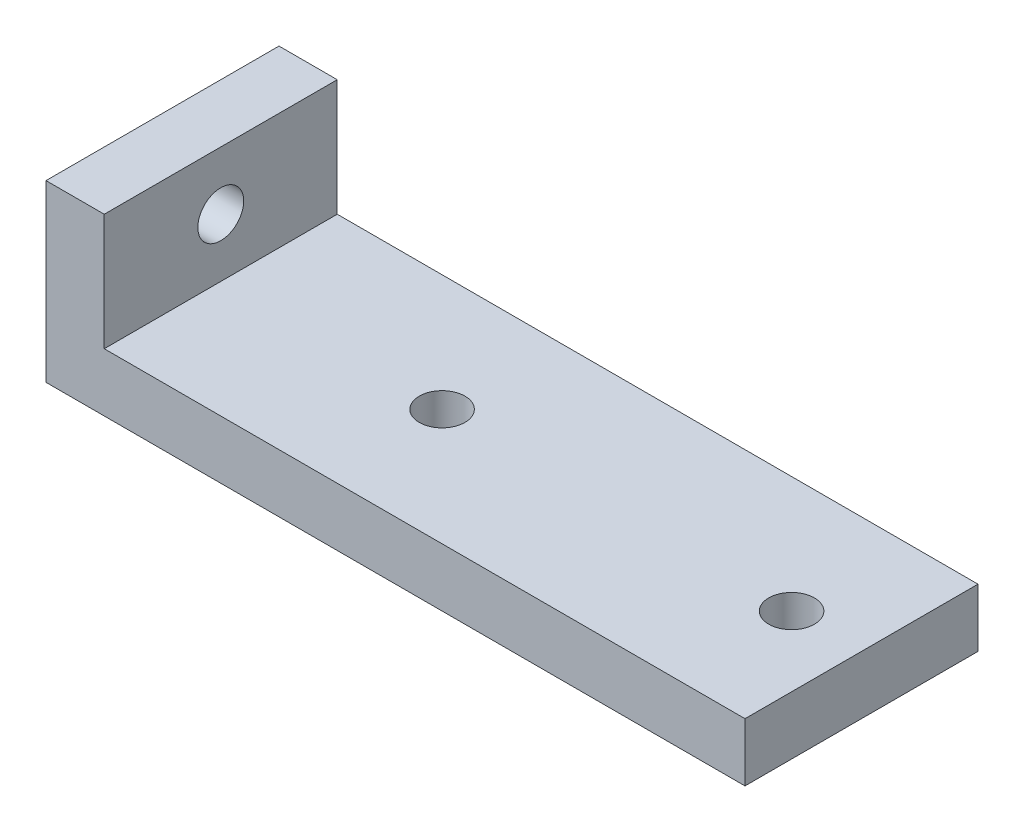
from build123d import *

# Parameters (mm, degrees)
SKETCH1_W                  = 76.2
SKETCH1_H                  = 25.4
BOSS_EXTRUDE1_DEPTH        = 19.05
SKETCH2_W                  = 69.85
SKETCH2_H                  = 12.7
CUT_EXTRUDE1_DEPTH         = 83.55
M6X1_0_TAPPED_HOLE1_D      = 5
F_9_0_196_DIAMETER_HOLE1_D = 4.9784


with BuildPart() as part:
    # Sketch1 → Boss-Extrude1 (new body)
    with BuildSketch(Plane(origin=(0, 0, 0), x_dir=(1, 0, 0), z_dir=(0, 1, 0))):
        with Locations((-38.1, 12.7)):
            Rectangle(SKETCH1_W, SKETCH1_H)
    extrude(amount=BOSS_EXTRUDE1_DEPTH)

    # Sketch2 → Cut-Extrude1 (cut, through all)
    with BuildSketch(Plane.XY):
        with Locations((-34.925, 12.7)):
            Rectangle(SKETCH2_W, SKETCH2_H)
    extrude(amount=-CUT_EXTRUDE1_DEPTH, mode=Mode.SUBTRACT)

    # M6x1.0 Tapped Hole1 (through all)
    with Locations(Plane.ZY.offset(76.2)):
        with Locations((-12.7, 12.7)):
            Hole(M6X1_0_TAPPED_HOLE1_D / 2)

    # #9 (0.196) Diameter Hole1 (through all)
    with Locations(Plane(origin=(0, 6.35, 0), x_dir=(1, 0, 0), z_dir=(0, 1, 0))):
        with Locations((-45.72, 12.7), (-7.62, 12.7)):
            Hole(F_9_0_196_DIAMETER_HOLE1_D / 2)


solid = part.part
